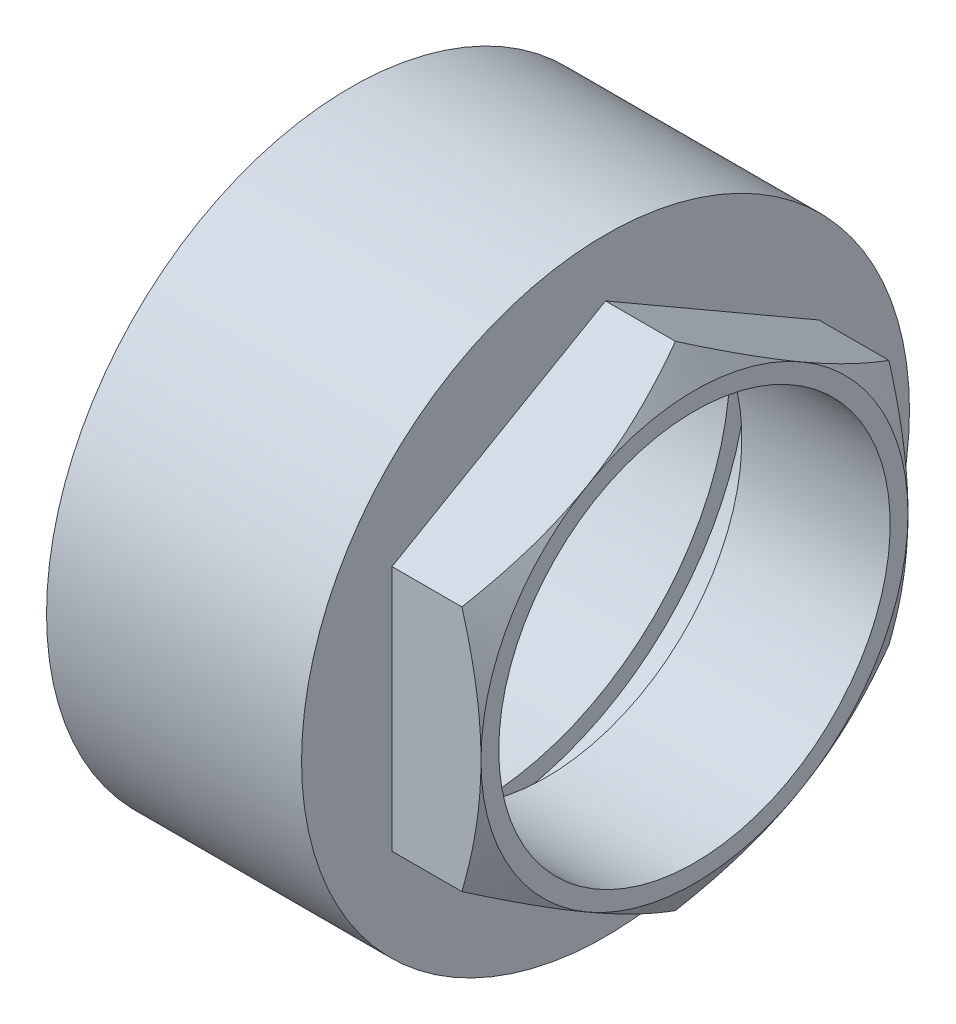
from build123d import *

# Parameters (mm, degrees)
SKETCH_2_R      = 25.625
EXTRUDE_1_DEPTH = 21.5
EXTRUDE_2_DEPTH = 7.5


with BuildPart() as part:
    # 草圖2 → 伸長1 (new body)
    with BuildSketch(Plane(origin=(0, 0, 0), x_dir=(0, 0, -1), z_dir=(1, 0, 0))):
        Circle(SKETCH_2_R)
    extrude(amount=EXTRUDE_1_DEPTH)

    # 草圖3 → 伸長2 (add)
    with BuildSketch(Plane(origin=(21.5, 0, 0), x_dir=(0, 0, -1), z_dir=(1, 0, 0))):
        Polygon((0, 20.784609691), (-18, 10.392304845), (-18, -10.392304845), (0, -20.784609691), (18, -10.392304845), (18, 10.392304845), align=None)
    extrude(amount=EXTRUDE_2_DEPTH)

    # 草圖4 → 除料-旋轉1 (revolve, cut)
    with BuildSketch(Plane.XY):
        Polygon((27.392304845, 20.784609691), (29, 20.784609691), (29, 18), align=None)
    revolve(axis=Axis((0, 0, 0), (1, 0, 0)), mode=Mode.SUBTRACT)

    # 草圖5 → 除料-旋轉2 (revolve, cut)
    with BuildSketch(Plane.XY, mode=Mode.PRIVATE) as cut_revolve_2_sk:
        Polygon((0, 0), (0, 21.5), (10.5, 21.5), (10.5, 23), (16.5, 23), (16.5, 16.5), (29, 16.5), (29, 0), align=None)
    revolve(cut_revolve_2_sk.sketch.rotate(Axis((0, 0, 0), (1, 0, 0)), 90), axis=Axis((0, 0, 0), (1, 0, 0)), mode=Mode.SUBTRACT)


solid = part.part
